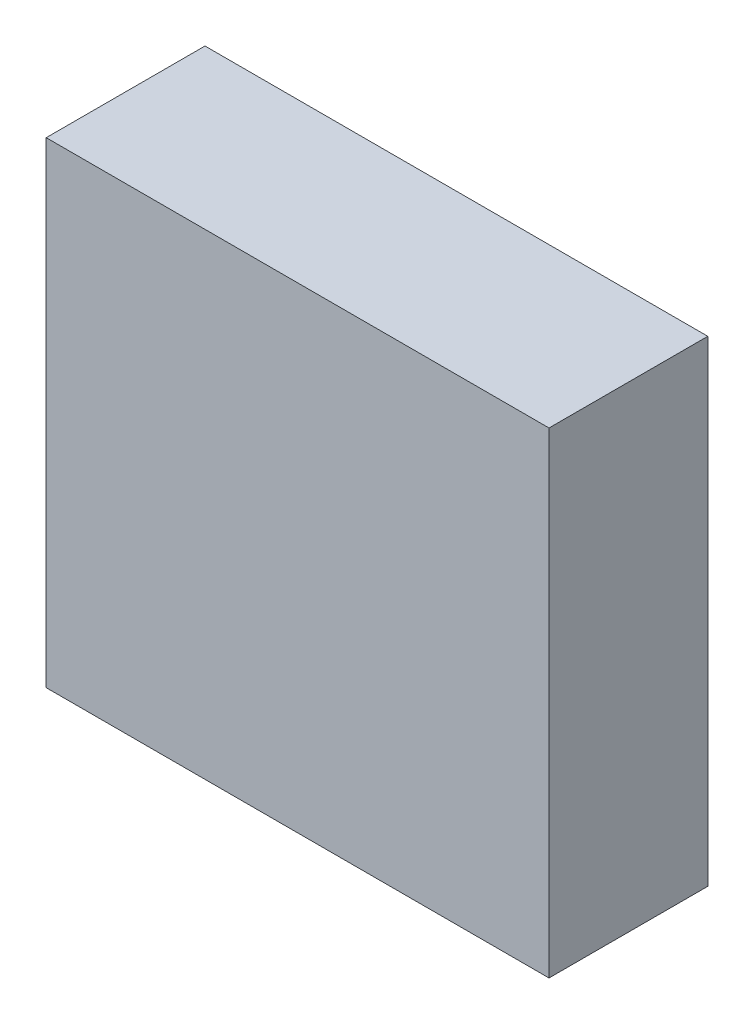
from build123d import *

# Parameters (mm, degrees)
SKETCH1_W           = 95
SKETCH1_H           = 90
BOSS_EXTRUDE1_DEPTH = 30


with BuildPart() as part:
    # Sketch1 → Boss-Extrude1 (new body)
    with BuildSketch(Plane.XY):
        Rectangle(SKETCH1_W, SKETCH1_H)
    extrude(amount=BOSS_EXTRUDE1_DEPTH)


solid = part.part
